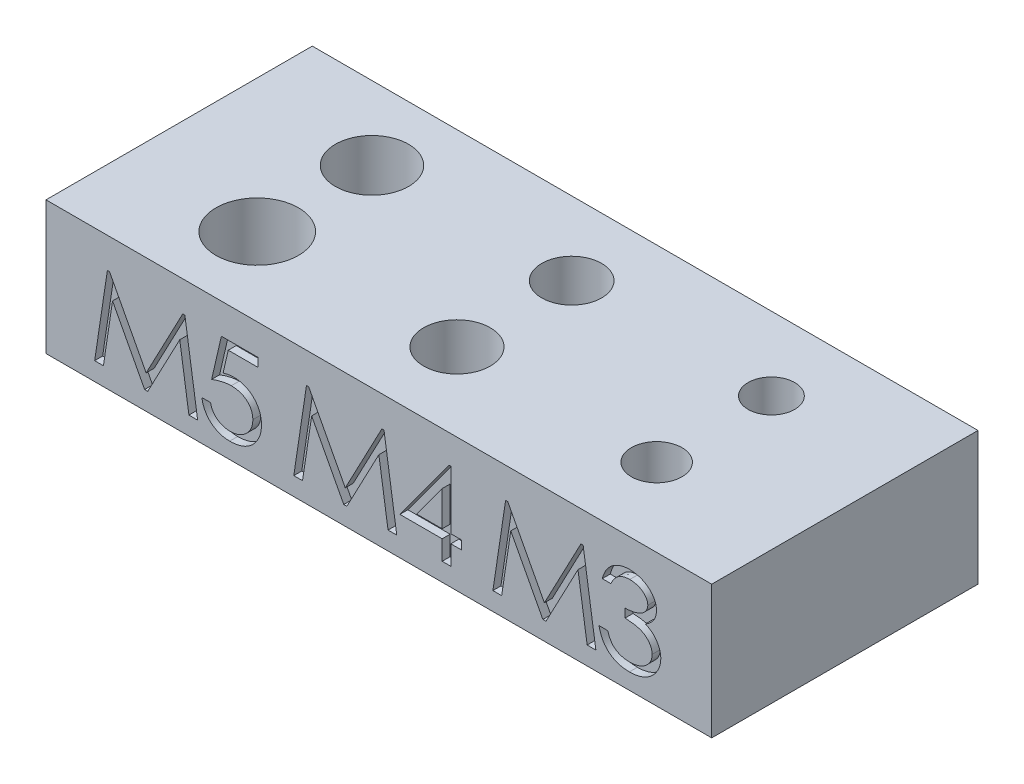
from build123d import *

# Parameters (mm, degrees)
SKETCH1_W           = 50
SKETCH1_H           = 20
BOSS_EXTRUDE1_DEPTH = 10
SKETCH2_R           = 2.75
SKETCH2_R_2         = 2.25
SKETCH2_R_3         = 1.75
SKETCH2_R_4         = 3.1
SKETCH2_R_5         = 2.5
SKETCH2_R_6         = 1.9
CUT_EXTRUDE1_DEPTH  = 55.772255751
CUT_EXTRUDE2_DEPTH  = 0.6
SKETCH4_W           = 0.89551282
SKETCH4_H           = 6.35
CUT_EXTRUDE3_DEPTH  = 0.6


with BuildPart() as part:
    # Sketch1 → Boss-Extrude1 (new body)
    with BuildSketch(Plane(origin=(0, 0, 0), x_dir=(1, 0, 0), z_dir=(0, 1, 0))):
        with Locations((25, 10)):
            Rectangle(SKETCH1_W, SKETCH1_H)
    extrude(amount=BOSS_EXTRUDE1_DEPTH)

    # Sketch2 → Cut-Extrude1 (cut, through all)
    with BuildSketch(Plane(origin=(0, 10, 0), x_dir=(1, 0, 0), z_dir=(0, 1, 0))):
        with Locations(Location((10, 14.483333333, 0), (0, 0, 270))):
            Circle(SKETCH2_R)
        with Locations(Location((25, 14.483333333, 0), (0, 0, 270))):
            Circle(SKETCH2_R_2)
        with Locations(Location((40, 14.483333333, 0), (0, 0, 270))):
            Circle(SKETCH2_R_3)
        with Locations(Location((10, 5.866666667, 0), (0, 0, 270))):
            Circle(SKETCH2_R_4)
        with Locations(Location((25, 5.866666667, 0), (0, 0, 270))):
            Circle(SKETCH2_R_5)
        with Locations(Location((40, 5.866666667, 0), (0, 0, 270))):
            Circle(SKETCH2_R_6)
    extrude(amount=-CUT_EXTRUDE1_DEPTH, mode=Mode.SUBTRACT)

    # Sketch3 → Cut-Extrude2 (cut)
    # profile 1 of 6: a face of its own
    with BuildSketch(Plane.XY):
        Polygon((3.65509305, 1.364651069), (4.610391528, 7.714651069), (4.769395935, 7.714651069), (7.52208023, 2.504394658), (10.270948419, 7.714651069), (10.431224861, 7.714651069), (11.389067409, 1.364651069), (10.733969252, 1.364651069), (10.045798178, 5.923625427), (7.641651544, 1.364651069), (7.407597056, 1.364651069), (4.998362281, 5.923625427), (4.312735278, 1.364651069), align=None)
    # profile 2 of 6: a face of its own
    with BuildSketch(Plane.XY):
        with BuildLine():
            Line((15.939900742, 7.714651069), (15.939900742, 7.063369017))
            Line((15.939900742, 7.063369017), (13.688398339, 7.063369017))
            Line((13.688398339, 7.063369017), (13.300427585, 5.385554514))
            add(Edge.make_bspline(
                [(13.300427585, 5.385554514), (13.370987319, 5.405675405), (13.507713656, 5.444664436), (13.71026727, 5.484247446), (13.901731228, 5.512470489), (14.026241932, 5.515235154), (14.086545374, 5.516574145)],
                knots=[0, 0, 0, 0, 1.100584957, 2.132646227, 3.095596962, 4, 4, 4, 4], degree=3))
            add(Edge.make_bspline(
                [(14.086545374, 5.516574145), (14.160840492, 5.515029578), (14.307010394, 5.511990762), (14.520744065, 5.483163244), (14.724745656, 5.437434639), (14.918659863, 5.373744211), (15.103281117, 5.292366363), (15.276890749, 5.190518103), (15.441994473, 5.072538224), (15.593609148, 4.934955257), (15.731339533, 4.784472983), (15.854067588, 4.623642597), (15.955097458, 4.450817456), (16.041066775, 4.269358427), (16.103272444, 4.075601134), (16.151065892, 3.872894957), (16.17949778, 3.659359826), (16.182566993, 3.513627191), (16.184131512, 3.439340572)],
                knots=[0, 0, 0, 0, 1.077151714, 2.119212705, 3.121851832, 4.105966215, 5.075130764, 6.042439667, 7.020500988, 8.01341629, 9.005912455, 9.976422566, 10.941539175, 11.904595977, 12.882869982, 13.886885156, 14.922848286, 16, 16, 16, 16], degree=3))
            add(Edge.make_bspline(
                [(16.184131512, 3.439340572), (16.183045707, 3.387583707), (16.180887996, 3.284732466), (16.166913704, 3.132106103), (16.142588476, 2.982524732), (16.108469754, 2.83620584), (16.063479741, 2.693658273), (16.01012986, 2.554018194), (15.945869951, 2.418077596), (15.874410693, 2.284837144), (15.792725125, 2.158356055), (15.705103682, 2.037939828), (15.609303992, 1.926219449), (15.507416538, 1.821113856), (15.397702135, 1.724712588), (15.281597602, 1.634993725), (15.158024515, 1.553821885), (15.027947633, 1.480045639), (14.89243559, 1.413487293), (14.750288562, 1.358110316), (14.60438319, 1.309535497), (14.452780553, 1.269655341), (14.295909231, 1.239525074), (14.13361189, 1.218436528), (13.966837372, 1.203239208), (13.853798436, 1.202304284), (13.796521335, 1.201830556)],
                knots=[0, 0, 0, 0, 1.016499425, 2.019987615, 3.007067189, 3.990768755, 4.967927679, 5.940676635, 6.924201944, 7.919118939, 8.907813052, 9.878849546, 10.841710254, 11.795707484, 12.751447708, 13.707514388, 14.675260193, 15.652383633, 16.643074722, 17.637399078, 18.645988148, 19.661975783, 20.713747707, 21.780771562, 22.875511604, 24, 24, 24, 24], degree=3))
            add(Edge.make_bspline(
                [(13.796521335, 1.201830556), (13.728169346, 1.203081247), (13.593987169, 1.205536486), (13.39762204, 1.231202795), (13.208760381, 1.268504951), (13.028360738, 1.32358764), (12.855336666, 1.393180421), (12.69232496, 1.481023583), (12.53567545, 1.581488139), (12.389237485, 1.698387932), (12.253514709, 1.827100356), (12.132512565, 1.967234663), (12.022719692, 2.114177642), (11.932446191, 2.273522512), (11.851757325, 2.43924745), (11.789141326, 2.615735717), (11.738553694, 2.80064868), (11.717331749, 2.92817263), (11.706567409, 2.992856197)],
                knots=[0, 0, 0, 0, 1.085877747, 2.131692758, 3.142880474, 4.14286505, 5.125366391, 6.102257235, 7.081864604, 8.079734589, 9.076078377, 10.05059479, 11.019852918, 11.986271429, 12.957004748, 13.94627934, 14.958297804, 16, 16, 16, 16], degree=3))
            Line((11.706567409, 2.992856197), (12.35784946, 2.992856197))
            add(Edge.make_bspline(
                [(12.35784946, 2.992856197), (12.372731615, 2.932289895), (12.401359142, 2.81578368), (12.462908648, 2.651960734), (12.539145997, 2.506065714), (12.630545645, 2.376642918), (12.73826844, 2.263099145), (12.861857094, 2.162286596), (13.000592333, 2.071689536), (13.154233711, 1.99539193), (13.31640923, 1.931309383), (13.486114773, 1.887576653), (13.658941557, 1.857801258), (13.776044188, 1.854677036), (13.834682393, 1.853112607)],
                knots=[0, 0, 0, 0, 1.105255689, 2.126085831, 3.094714204, 4.016847766, 4.926388513, 5.861187163, 6.839282794, 7.858145028, 8.898395173, 9.925188997, 10.961054995, 12, 12, 12, 12], degree=3))
            add(Edge.make_bspline(
                [(13.834682393, 1.853112607), (13.892000915, 1.854587362), (14.004509538, 1.857482109), (14.1700337, 1.88010349), (14.329673488, 1.91484218), (14.482427406, 1.96683681), (14.630704622, 2.030010226), (14.770945495, 2.110767568), (14.906173386, 2.204434438), (15.032938282, 2.311468505), (15.149758704, 2.428897321), (15.252245361, 2.555386451), (15.338866803, 2.689459825), (15.411104993, 2.83012928), (15.466004999, 2.97837911), (15.503435546, 3.133894665), (15.529132635, 3.296022952), (15.531595696, 3.407012561), (15.53284946, 3.463509242)],
                knots=[0, 0, 0, 0, 1.055051283, 2.070925109, 3.071045655, 4.058623374, 5.037677312, 6.034164763, 7.032607791, 8.063255273, 9.08460474, 10.078366321, 11.055051477, 12.018762383, 12.984653025, 13.957962099, 14.960548061, 16, 16, 16, 16], degree=3))
            add(Edge.make_bspline(
                [(15.53284946, 3.463509242), (15.531929411, 3.514483602), (15.530126415, 3.614376634), (15.507106271, 3.759940141), (15.473504789, 3.898331729), (15.424572376, 4.02928705), (15.361919393, 4.152732952), (15.286698378, 4.270049697), (15.195441833, 4.377870188), (15.092343386, 4.478394858), (14.978529244, 4.569672707), (14.854252497, 4.649527587), (14.719491474, 4.714758975), (14.577279382, 4.772007643), (14.424603562, 4.812912198), (14.263571577, 4.843961016), (14.092865752, 4.861448515), (13.975915817, 4.863991359), (13.916092649, 4.865292094)],
                knots=[0, 0, 0, 0, 1.015670352, 1.990380851, 2.931800134, 3.852286557, 4.771295661, 5.688435274, 6.625018434, 7.581846215, 8.556520028, 9.530055911, 10.520920521, 11.538525318, 12.582836159, 13.667522609, 14.806872476, 16, 16, 16, 16], degree=3))
            add(Edge.make_bspline(
                [(13.916092649, 4.865292094), (13.86390449, 4.864263385), (13.756775147, 4.862151701), (13.592029631, 4.845864452), (13.419254314, 4.820451763), (13.238470287, 4.784538537), (13.049722008, 4.738331966), (12.85286796, 4.682279567), (12.647891862, 4.616219246), (12.509900107, 4.565576153), (12.439259717, 4.539651069)],
                knots=[0, 0, 0, 0, 0.823935763, 1.691335702, 2.611665863, 3.580679742, 4.600450859, 5.679197418, 6.811940615, 8, 8, 8, 8], degree=3))
            Line((12.439259717, 4.539651069), (13.171952024, 7.714651069))
            Line((13.171952024, 7.714651069), (15.939900742, 7.714651069))
        make_face()
    # profile 3 of 6: a face of its own
    with BuildSketch(Plane.XY):
        Polygon((18.610157153, 1.364651069), (19.56545563, 7.714651069), (19.724460037, 7.714651069), (22.477144332, 2.504394658), (25.226012521, 7.714651069), (25.386288964, 7.714651069), (26.344131512, 1.364651069), (25.689033355, 1.364651069), (25.000862281, 5.923625427), (22.596715646, 1.364651069), (22.362661159, 1.364651069), (19.953426383, 5.923625427), (19.26779938, 1.364651069), align=None)
    # profile 4 of 6: a face of its own
    with BuildSketch(Plane.XY):
        Polygon((30.27421164, 7.877471581), (30.406503306, 7.877471581), (30.406503306, 3.481317735), (31.220605871, 3.481317735), (31.220605871, 2.830035684), (30.406503306, 2.830035684), (30.406503306, 1.364651069), (29.755221255, 1.364651069), (29.755221255, 2.830035684), (26.580221255, 2.830035684), align=None)
        Polygon((29.755221255, 3.481317735), (29.755221255, 6.096622222), (27.84208023, 3.481317735), align=None, mode=Mode.SUBTRACT)
    # profile 5 of 6: a face of its own
    with BuildSketch(Plane.XY):
        Polygon((33.565221255, 1.364651069), (34.520519733, 7.714651069), (34.67952414, 7.714651069), (37.432208435, 2.504394658), (40.181076624, 7.714651069), (40.341353066, 7.714651069), (41.299195614, 1.364651069), (40.644097457, 1.364651069), (39.955926383, 5.923625427), (37.551779749, 1.364651069), (37.317725262, 1.364651069), (34.908490486, 5.923625427), (34.222863483, 1.364651069), align=None)
    # profile 6 of 6: a face of its own
    with BuildSketch(Plane.XY):
        with BuildLine():
            Line((42.430798178, 6.249266453), (41.779516127, 6.249266453))
            add(Edge.make_bspline(
                [(41.779516127, 6.249266453), (41.796677211, 6.313205493), (41.830262922, 6.438339671), (41.897951554, 6.617171518), (41.973464076, 6.785782868), (42.061630414, 6.942820568), (42.16093971, 7.088675829), (42.272613442, 7.222299096), (42.392930895, 7.346805705), (42.526207319, 7.456887423), (42.666600655, 7.556245763), (42.815085362, 7.641624392), (42.969517399, 7.714350735), (43.130148312, 7.774622449), (43.297639293, 7.820169594), (43.470744598, 7.852897661), (43.650142034, 7.874368119), (43.771884423, 7.876424734), (43.833853066, 7.877471581)],
                knots=[0, 0, 0, 0, 1.116355944, 2.184804219, 3.222141051, 4.231113984, 5.219328683, 6.194876446, 7.166217883, 8.136267484, 9.106844572, 10.065215996, 11.022117626, 11.98422021, 12.956167426, 13.946761748, 14.954871942, 16, 16, 16, 16], degree=3))
            add(Edge.make_bspline(
                [(43.833853066, 7.877471581), (43.923924961, 7.874958983), (44.102165866, 7.86998687), (44.364134678, 7.824992141), (44.616723672, 7.75364696), (44.856937478, 7.654892465), (45.079899302, 7.53288496), (45.279290996, 7.388945874), (45.449931068, 7.222663664), (45.593937965, 7.040355231), (45.706545854, 6.844767595), (45.789530025, 6.643627927), (45.840226299, 6.437046782), (45.846760975, 6.297452526), (45.850028947, 6.227641854)],
                knots=[0, 0, 0, 0, 1.123321227, 2.222910833, 3.306649022, 4.393470362, 5.456864647, 6.471880394, 7.452320752, 8.420908763, 9.362108778, 10.259259549, 11.129460877, 12, 12, 12, 12], degree=3))
            add(Edge.make_bspline(
                [(45.850028947, 6.227641854), (45.847825879, 6.160436344), (45.843504981, 6.028625599), (45.802237937, 5.836787008), (45.7370675, 5.655643062), (45.64610707, 5.484554147), (45.526919856, 5.325920982), (45.383265456, 5.17730561), (45.212577174, 5.04057811), (45.085173958, 4.961891233), (45.019389925, 4.921261645)],
                knots=[0, 0, 0, 0, 0.989635591, 1.940980818, 2.878257013, 3.820688598, 4.785857322, 5.793802215, 6.860840457, 8, 8, 8, 8], degree=3))
            add(Edge.make_bspline(
                [(45.019389925, 4.921261645), (45.092914796, 4.888847216), (45.237370182, 4.825162113), (45.434402957, 4.697366595), (45.614090666, 4.552222003), (45.71462677, 4.436919896), (45.764802585, 4.379374626)],
                knots=[0, 0, 0, 0, 1.034096765, 2.031705015, 3.017658317, 4, 4, 4, 4], degree=3))
            add(Edge.make_bspline(
                [(45.764802585, 4.379374626), (45.797944037, 4.337618025), (45.863445708, 4.255089138), (45.944651702, 4.121503567), (46.017954515, 3.986737876), (46.073840785, 3.846091167), (46.121112287, 3.70337192), (46.152350805, 3.555759057), (46.172056546, 3.4046872), (46.174461634, 3.302446204), (46.175669973, 3.251079354)],
                knots=[0, 0, 0, 0, 1.043047349, 2.06150724, 3.057059767, 4.044020338, 5.020973223, 5.99827899, 6.994316291, 8, 8, 8, 8], degree=3))
            add(Edge.make_bspline(
                [(46.175669973, 3.251079354), (46.174585816, 3.206524712), (46.172422621, 3.117625766), (46.158219822, 2.984913993), (46.134204648, 2.853888082), (46.099340456, 2.724285884), (46.054767477, 2.596504944), (46.001639193, 2.469855631), (45.936668328, 2.34621745), (45.865610464, 2.223355186), (45.783944566, 2.105807276), (45.696055204, 1.993305711), (45.601305459, 1.88733765), (45.496654071, 1.791073571), (45.387980816, 1.698489652), (45.270152859, 1.61520642), (45.146788315, 1.536760953), (45.015831683, 1.467527462), (44.879536212, 1.404995556), (44.738943168, 1.350602871), (44.594228163, 1.304155421), (44.445675456, 1.268025416), (44.293325741, 1.238378091), (44.137102182, 1.216783125), (43.976547748, 1.203706289), (43.868222594, 1.202460091), (43.813500502, 1.201830556)],
                knots=[0, 0, 0, 0, 0.92169803, 1.839044851, 2.757774576, 3.674827786, 4.612457936, 5.555774093, 6.513016878, 7.499902905, 8.490174619, 9.47107816, 10.452334622, 11.426626846, 12.410467524, 13.403648671, 14.408766131, 15.432992845, 16.465300959, 17.509466555, 18.549756312, 19.60710264, 20.67025462, 21.759431652, 22.868142969, 24, 24, 24, 24], degree=3))
            add(Edge.make_bspline(
                [(43.813500502, 1.201830556), (43.74010014, 1.203380356), (43.596365355, 1.206415222), (43.385223536, 1.227754637), (43.184166598, 1.266189575), (42.992010969, 1.31873331), (42.808480351, 1.384154845), (42.63447577, 1.466315737), (42.469835502, 1.562991074), (42.315727021, 1.67518299), (42.172739392, 1.80177323), (42.041106743, 1.94161728), (41.923701081, 2.096811859), (41.819642553, 2.265326982), (41.726759047, 2.446917306), (41.650880365, 2.643688547), (41.582731648, 2.852945798), (41.551357701, 2.999294487), (41.535285358, 3.074266453)],
                knots=[0, 0, 0, 0, 1.089030947, 2.132572979, 3.144340947, 4.122636792, 5.085826611, 6.031433048, 6.973369982, 7.914634373, 8.855057411, 9.803109251, 10.759391439, 11.737019511, 12.738643989, 13.780724783, 14.863102731, 16, 16, 16, 16], degree=3))
            Line((41.535285358, 3.074266453), (42.186567409, 3.074266453))
            add(Edge.make_bspline(
                [(42.186567409, 3.074266453), (42.202247564, 3.025359663), (42.232762545, 2.930182686), (42.284596913, 2.793342376), (42.34286855, 2.66751202), (42.406916277, 2.5527439), (42.474145643, 2.447635544), (42.546883581, 2.352771413), (42.625151967, 2.268587981), (42.682591606, 2.220196976), (42.710645935, 2.196562126)],
                knots=[0, 0, 0, 0, 1.187591516, 2.311159086, 3.381569441, 4.391100686, 5.348474685, 6.26437783, 7.152297666, 8, 8, 8, 8], degree=3))
            add(Edge.make_bspline(
                [(42.710645935, 2.196562126), (42.747916259, 2.169152978), (42.822411428, 2.114368129), (42.943436189, 2.044194115), (43.07125665, 1.984061236), (43.208184459, 1.937565973), (43.35118713, 1.898872923), (43.502384177, 1.87289857), (43.660446674, 1.855492611), (43.768505756, 1.853917037), (43.823676784, 1.853112607)],
                knots=[0, 0, 0, 0, 0.934841818, 1.868542889, 2.823608252, 3.786147903, 4.788489089, 5.816032122, 6.884945635, 8, 8, 8, 8], degree=3))
            add(Edge.make_bspline(
                [(43.823676784, 1.853112607), (43.886490501, 1.854223258), (44.009028601, 1.856389935), (44.187472967, 1.876439527), (44.356806619, 1.905723879), (44.515933098, 1.95133333), (44.667180436, 2.006080877), (44.807326535, 2.077402351), (44.93939228, 2.158268263), (45.059541934, 2.252783832), (45.168044156, 2.354613803), (45.262821112, 2.462110116), (45.343953281, 2.57335114), (45.410384636, 2.689231945), (45.462197478, 2.809920989), (45.497290079, 2.93532436), (45.519858023, 3.064553559), (45.522869442, 3.152191311), (45.524387922, 3.196381838)],
                knots=[0, 0, 0, 0, 1.249364874, 2.437282909, 3.569203944, 4.664369636, 5.726875827, 6.764470109, 7.787556699, 8.80352195, 9.800248248, 10.744722387, 11.650966389, 12.535226244, 13.397106462, 14.257002303, 15.1211095, 16, 16, 16, 16], degree=3))
            add(Edge.make_bspline(
                [(45.524387922, 3.196381838), (45.521833202, 3.255596664), (45.516727772, 3.37393335), (45.470917451, 3.547374491), (45.399191431, 3.715033201), (45.297704519, 3.873128605), (45.174125813, 4.01988414), (45.029223795, 4.14965984), (44.863987491, 4.258623457), (44.710836411, 4.33282007), (44.574957174, 4.382973103), (44.459056005, 4.41740601), (44.32957773, 4.445760437), (44.187156321, 4.472822157), (44.031338532, 4.495111828), (43.862517636, 4.514234816), (43.680534098, 4.529473954), (43.554451099, 4.536177944), (43.489131512, 4.539651069)],
                knots=[0, 0, 0, 0, 1.042984283, 2.08433108, 3.143128335, 4.249222157, 5.385113909, 6.51878688, 7.668120448, 8.865777362, 9.511886398, 10.22190494, 10.99673624, 11.849106467, 12.778958184, 13.77268577, 14.846099398, 16, 16, 16, 16], degree=3))
            Line((43.489131512, 4.539651069), (43.489131512, 5.19093312))
            add(Edge.make_bspline(
                [(43.489131512, 5.19093312), (43.571503015, 5.192268189), (43.732977914, 5.194885359), (43.969170161, 5.226506849), (44.19510696, 5.269983974), (44.405648627, 5.336897265), (44.597096765, 5.41464666), (44.763168967, 5.504975814), (44.901623705, 5.605381939), (45.011839197, 5.717484157), (45.0949695, 5.837817837), (45.154925564, 5.963526765), (45.192556262, 6.094879312), (45.196679413, 6.184997626), (45.198746896, 6.230185924)],
                knots=[0, 0, 0, 0, 1.341656069, 2.630081648, 3.878419675, 5.087257311, 6.224426624, 7.242095775, 8.16131872, 9.001938776, 9.791789743, 10.533744472, 11.264771053, 12, 12, 12, 12], degree=3))
            add(Edge.make_bspline(
                [(45.198746896, 6.230185924), (45.19743381, 6.263333945), (45.194822445, 6.329256191), (45.176710608, 6.42590966), (45.146757211, 6.519429131), (45.10526337, 6.609698363), (45.049033603, 6.695419258), (44.982863785, 6.778305038), (44.904606624, 6.85781852), (44.814306991, 6.931607678), (44.716613574, 7.001649534), (44.610070656, 7.061345285), (44.497719335, 7.112346462), (44.37915659, 7.154698297), (44.253794561, 7.186087534), (44.122421789, 7.208875586), (43.984687991, 7.22313932), (43.89070532, 7.225159087), (43.842757313, 7.22618953)],
                knots=[0, 0, 0, 0, 0.853648546, 1.697670886, 2.523188139, 3.378302657, 4.247803805, 5.156940784, 6.106885888, 7.11512794, 8.157515917, 9.199274311, 10.255022773, 11.332799812, 12.437414037, 13.579407759, 14.765064121, 16, 16, 16, 16], degree=3))
            add(Edge.make_bspline(
                [(43.842757313, 7.22618953), (43.765790976, 7.223728461), (43.616155193, 7.218943721), (43.400117543, 7.175239325), (43.199170314, 7.107375439), (43.045253971, 7.024588579), (42.931601467, 6.94328002), (42.850047016, 6.872874881), (42.771418175, 6.793189316), (42.697238858, 6.702585808), (42.624535192, 6.603542376), (42.555617047, 6.494803386), (42.490729463, 6.376001871), (42.451149492, 6.292302945), (42.430798178, 6.249266453)],
                knots=[0, 0, 0, 0, 1.509259838, 2.934260404, 4.308252053, 5.660031487, 6.34601821, 7.048371135, 7.772289125, 8.540633061, 9.344706165, 10.182863007, 11.065660648, 12, 12, 12, 12], degree=3))
        make_face()
    extrude(amount=-CUT_EXTRUDE2_DEPTH, mode=Mode.SUBTRACT)

    # Sketch4 → Cut-Extrude3 (cut)
    with BuildSketch(Plane.ZY):
        with BuildLine():
            Line((-16.84631779, 2.511731393), (-16.046207614, 2.833556312))
            add(Edge.make_bspline(
                [(-16.046207614, 2.833556312), (-15.977769578, 2.749521943), (-15.844917775, 2.58639456), (-15.625968174, 2.370708047), (-15.400183633, 2.186528297), (-15.164969013, 2.036635528), (-14.92169227, 1.919367331), (-14.670354552, 1.836305027), (-14.410802143, 1.784456682), (-14.234644944, 1.778318984), (-14.145786941, 1.775222979)],
                knots=[0, 0, 0, 0, 1.152089572, 2.236434419, 3.262720936, 4.246162169, 5.196317325, 6.127660375, 7.055546052, 8, 8, 8, 8], degree=3))
            add(Edge.make_bspline(
                [(-14.145786941, 1.775222979), (-14.069793842, 1.77675945), (-13.919819959, 1.779791707), (-13.699020582, 1.809099859), (-13.485105334, 1.854337055), (-13.281395166, 1.918997622), (-13.09165324, 1.996984699), (-12.924229417, 2.09107462), (-12.780460409, 2.197490038), (-12.661599684, 2.315697038), (-12.567916827, 2.44288837), (-12.501230748, 2.575409358), (-12.456706029, 2.71157886), (-12.452342581, 2.804813463), (-12.450163944, 2.851364806)],
                knots=[0, 0, 0, 0, 1.238349031, 2.443906286, 3.624874093, 4.798942716, 5.923617549, 6.963699705, 7.921824088, 8.83101724, 9.686901663, 10.484521922, 11.243333087, 12, 12, 12, 12], degree=3))
            add(Edge.make_bspline(
                [(-12.450163944, 2.851364806), (-12.453837322, 2.904494344), (-12.461410666, 3.014030624), (-12.526544803, 3.173612689), (-12.626916277, 3.33098321), (-12.716705391, 3.424847902), (-12.764356652, 3.474662082)],
                knots=[0, 0, 0, 0, 0.887223272, 1.829173364, 2.84793798, 4, 4, 4, 4], degree=3))
            add(Edge.make_bspline(
                [(-12.764356652, 3.474662082), (-12.803739038, 3.511252581), (-12.887576527, 3.589146682), (-13.031090955, 3.701081612), (-13.195916313, 3.819578557), (-13.382334339, 3.943915442), (-13.592209619, 4.07208934), (-13.823504554, 4.20701362), (-14.077804024, 4.346532741), (-14.255846928, 4.439211514), (-14.348040546, 4.487202146)],
                knots=[0, 0, 0, 0, 0.684072347, 1.456257804, 2.314658692, 3.268296586, 4.307941752, 5.444813601, 6.676881395, 8, 8, 8, 8], degree=3))
            add(Edge.make_bspline(
                [(-14.348040546, 4.487202146), (-14.43981831, 4.53475575), (-14.615157238, 4.625605622), (-14.862507495, 4.760940036), (-15.084093123, 4.883581799), (-15.277808289, 4.996331585), (-15.443287524, 5.100228704), (-15.583910669, 5.190461239), (-15.696351648, 5.272209998), (-15.759027941, 5.326800947), (-15.786712421, 5.350914085)],
                knots=[0, 0, 0, 0, 1.475543639, 2.818986114, 4.02480104, 5.09096343, 6.018093619, 6.813867338, 7.476078347, 8, 8, 8, 8], degree=3))
            add(Edge.make_bspline(
                [(-15.786712421, 5.350914085), (-15.825520562, 5.388029899), (-15.900844213, 5.460068873), (-16.000361926, 5.575754604), (-16.08716381, 5.692351151), (-16.155046516, 5.813550425), (-16.210222921, 5.935764538), (-16.248106147, 6.061035794), (-16.272030509, 6.188695348), (-16.274976244, 6.274733045), (-16.276445995, 6.31766088)],
                knots=[0, 0, 0, 0, 1.153424584, 2.23870947, 3.275830823, 4.271613903, 5.218145226, 6.15209119, 7.078000373, 8, 8, 8, 8], degree=3))
            add(Edge.make_bspline(
                [(-16.276445995, 6.31766088), (-16.275413297, 6.351635707), (-16.273365024, 6.419022035), (-16.258571869, 6.518996328), (-16.236429106, 6.617303111), (-16.202198022, 6.712445746), (-16.16238045, 6.806783556), (-16.108988449, 6.896238181), (-16.049067234, 6.985243363), (-15.955024066, 7.10101003), (-15.814824595, 7.236382589), (-15.619353828, 7.380870881), (-15.391925364, 7.503700532), (-15.139360585, 7.609701326), (-14.865007768, 7.693030742), (-14.576878648, 7.756532158), (-14.276409019, 7.79173013), (-14.072518406, 7.796937453), (-13.96897404, 7.799581953)],
                knots=[0, 0, 0, 0, 0.539029401, 1.069121303, 1.601259569, 2.135436362, 2.671812815, 3.22354654, 3.785365854, 4.373914828, 5.587402901, 6.867381044, 8.219734826, 9.679516073, 11.207829841, 12.764024048, 14.356633122, 16, 16, 16, 16], degree=3))
            add(Edge.make_bspline(
                [(-13.96897404, 7.799581953), (-13.858590822, 7.797039784), (-13.640347901, 7.792013562), (-13.318674734, 7.747592602), (-13.008378853, 7.674804859), (-12.757377125, 7.591004685), (-12.560864791, 7.506401105), (-12.411269074, 7.430913301), (-12.260196954, 7.342575906), (-12.105799037, 7.243306657), (-11.949876525, 7.131269542), (-11.791641636, 7.007302196), (-11.631606959, 6.871560743), (-11.52672402, 6.774305639), (-11.473240867, 6.724712162)],
                knots=[0, 0, 0, 0, 1.422078643, 2.811646575, 4.175598256, 5.525232754, 6.215510619, 6.931566771, 7.683268332, 8.469968427, 9.296431584, 10.156744404, 11.06006522, 12, 12, 12, 12], degree=3))
            Line((-11.473240867, 6.724712162), (-12.241550162, 6.334197338))
            add(Edge.make_bspline(
                [(-12.241550162, 6.334197338), (-12.28670891, 6.374296895), (-12.373966314, 6.451778742), (-12.504422734, 6.560618886), (-12.62977225, 6.658520514), (-12.75092663, 6.745213654), (-12.866472918, 6.82138705), (-12.976336531, 6.888405164), (-13.081371643, 6.944763113), (-13.215768988, 7.003541256), (-13.384010852, 7.063450351), (-13.593067816, 7.112399593), (-13.81121523, 7.142456592), (-13.959547531, 7.146327667), (-14.035119873, 7.148299902)],
                knots=[0, 0, 0, 0, 1.074228015, 2.075663111, 3.021624324, 3.902793679, 4.724914158, 5.482914942, 6.191458127, 6.843165991, 8.090764799, 9.362211274, 10.656099381, 12, 12, 12, 12], degree=3))
            add(Edge.make_bspline(
                [(-14.035119873, 7.148299902), (-14.08346999, 7.147459212), (-14.17773508, 7.145820173), (-14.316335491, 7.136163191), (-14.447524889, 7.116941006), (-14.572255346, 7.090999896), (-14.690689856, 7.060522637), (-14.801517832, 7.018749016), (-14.906543796, 6.972093432), (-15.003589445, 6.917959646), (-15.090917136, 6.858335841), (-15.168293685, 6.796107083), (-15.233669153, 6.729585305), (-15.288039266, 6.659616328), (-15.32882006, 6.58503154), (-15.358685007, 6.507699551), (-15.377027349, 6.427055009), (-15.379626856, 6.372026726), (-15.380933174, 6.34437362)],
                knots=[0, 0, 0, 0, 1.344780428, 2.621831248, 3.86091427, 5.028822096, 6.164433506, 7.257555437, 8.318398087, 9.358390499, 10.342883404, 11.256382275, 12.115274943, 12.931328421, 13.712469561, 14.47020682, 15.231240198, 16, 16, 16, 16], degree=3))
            add(Edge.make_bspline(
                [(-15.380933174, 6.34437362), (-15.379705457, 6.310265359), (-15.377230622, 6.241509887), (-15.349095844, 6.140537583), (-15.310324278, 6.03955189), (-15.250849862, 5.940085867), (-15.171319732, 5.83807921), (-15.063871959, 5.736445932), (-14.931959405, 5.629021544), (-14.832389727, 5.560482514), (-14.779260498, 5.52391088)],
                knots=[0, 0, 0, 0, 0.76880994, 1.549768002, 2.354129864, 3.208810305, 4.157741603, 5.269146009, 6.542847899, 8, 8, 8, 8], degree=3))
            add(Edge.make_bspline(
                [(-14.779260498, 5.52391088), (-14.758981052, 5.511491133), (-14.710532791, 5.481819952), (-14.623167919, 5.433377178), (-14.508397094, 5.374893951), (-14.368787036, 5.299726025), (-14.201067236, 5.215755483), (-14.007003873, 5.11839328), (-13.786149288, 5.009736439), (-13.630168517, 4.932454771), (-13.54793037, 4.891709357)],
                knots=[0, 0, 0, 0, 0.412210111, 0.984783423, 1.731088825, 2.645137316, 3.733213325, 4.982341228, 6.408991929, 8, 8, 8, 8], degree=3))
            add(Edge.make_bspline(
                [(-13.54793037, 4.891709357), (-13.448959011, 4.84159678), (-13.257752018, 4.744782154), (-12.984334783, 4.599316008), (-12.735717506, 4.456795652), (-12.511898215, 4.318207236), (-12.311359257, 4.185098849), (-12.135355707, 4.055501519), (-11.983054932, 3.930027467), (-11.854471454, 3.806512426), (-11.744665402, 3.685862349), (-11.651595719, 3.565314353), (-11.570600113, 3.44632995), (-11.505187075, 3.32627077), (-11.454877174, 3.205576675), (-11.419495682, 3.084834115), (-11.396460614, 2.963746751), (-11.393372134, 2.882841836), (-11.39183061, 2.842460559)],
                knots=[0, 0, 0, 0, 1.709562351, 3.302776476, 4.772177714, 6.124901424, 7.359068972, 8.480380071, 9.491865779, 10.397660351, 11.22576364, 12.003453628, 12.742868209, 13.441670434, 14.106660575, 14.753818965, 15.378005873, 16, 16, 16, 16], degree=3))
            add(Edge.make_bspline(
                [(-11.39183061, 2.842460559), (-11.393776264, 2.785426016), (-11.397651541, 2.671826853), (-11.436835769, 2.505386358), (-11.496840788, 2.344247015), (-11.582267428, 2.189223785), (-11.69129396, 2.039755985), (-11.824947931, 1.896796609), (-11.983032451, 1.760662248), (-12.161774904, 1.631353871), (-12.357839427, 1.51256728), (-12.566613781, 1.408095712), (-12.785847449, 1.320435568), (-13.015533609, 1.248713402), (-13.255473489, 1.193445526), (-13.505660771, 1.152532276), (-13.766219799, 1.127844681), (-13.943479064, 1.125259091), (-14.033847838, 1.123940928)],
                knots=[0, 0, 0, 0, 0.789167787, 1.571833384, 2.356547704, 3.16644455, 4.016223069, 4.914320835, 5.872282974, 6.903077527, 7.968268762, 9.045691288, 10.134668915, 11.236757733, 12.377033922, 13.543993062, 14.747899939, 16, 16, 16, 16], degree=3))
            add(Edge.make_bspline(
                [(-14.033847838, 1.123940928), (-14.103843508, 1.124853502), (-14.242307316, 1.126658735), (-14.447251509, 1.142991073), (-14.647498612, 1.165942512), (-14.84212856, 1.20250235), (-15.032500147, 1.246720238), (-15.217841893, 1.301066074), (-15.398141564, 1.366629249), (-15.573975767, 1.441305665), (-15.745917947, 1.528416042), (-15.91352186, 1.629140533), (-16.078450967, 1.742897301), (-16.239591883, 1.870260642), (-16.397969091, 2.010452555), (-16.551436923, 2.16486429), (-16.702462561, 2.331895201), (-16.797743657, 2.451007934), (-16.84631779, 2.511731393)],
                knots=[0, 0, 0, 0, 1.029753048, 2.037033552, 3.023718286, 3.994153229, 4.94908124, 5.898674701, 6.834164454, 7.770548408, 8.708074864, 9.667861764, 10.645669405, 11.654185788, 12.688370985, 13.756003842, 14.856014769, 16, 16, 16, 16], degree=3))
        make_face()
        with Locations((-5.570997277, 4.461761441)):
            Rectangle(SKETCH4_W, SKETCH4_H)
    extrude(amount=-CUT_EXTRUDE3_DEPTH, mode=Mode.SUBTRACT)


solid = part.part
